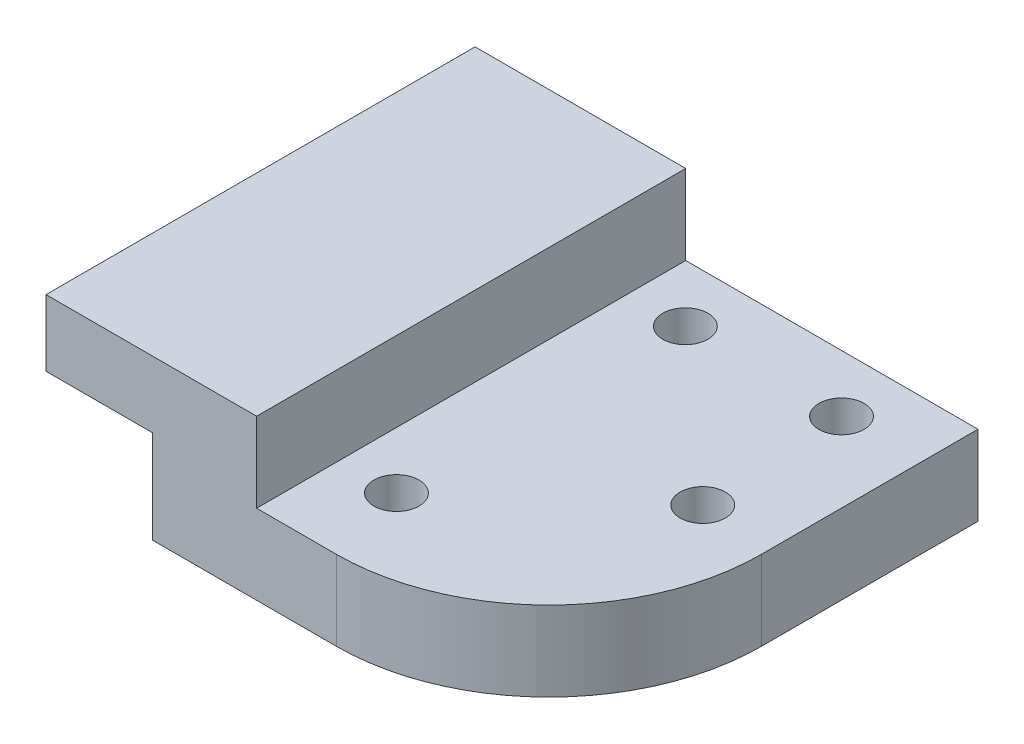
from build123d import *

# Parameters (mm, degrees)
BOSS_EXTRUDE1_DEPTH = 20
SKETCH3_W           = 8
SKETCH3_H           = 8
CUT_EXTRUDE1_DEPTH  = 10
SKETCH4_R           = 1
CUT_EXTRUDE2_DEPTH  = 10
SKETCH5_W           = 4
SKETCH5_H           = 20
CUT_EXTRUDE3_DEPTH  = 0.5
SKETCH6_W           = 8
SKETCH6_H           = 3
BOSS_EXTRUDE2_DEPTH = 8
SKETCH4_2_R         = 1
BOSS_EXTRUDE3_DEPTH = 3
SKETCH7_W           = 20
SKETCH7_H           = 3
BOSS_EXTRUDE4_DEPTH = 3
SKETCH8_W           = 21.136904569
SKETCH8_H           = 7.074304785
CUT_EXTRUDE4_DEPTH  = 3
SKETCH9_R           = 0.85
CUT_EXTRUDE6_DEPTH  = 3
FILLET1_R           = 8
SKETCH9_5_R         = 0.85
CUT_EXTRUDE8_DEPTH  = 3
SKETCH10_W          = 22.706583138
SKETCH10_H          = 8.880510261
CUT_EXTRUDE9_DEPTH  = 0.85
SKETCH4_3_R         = 1
BOSS_EXTRUDE6_DEPTH = 3


with BuildPart() as part:
    # Sketch1 → Boss-Extrude1 (new body)
    with BuildSketch(Plane.XY):
        Polygon((0, 0), (0, 3), (4, 3), (7.927272727, 3), (7.927272727, 0), (15.927272727, 0), (15.927272727, -3), (7.927272727, -3), (4, -3), (4, 0), align=None)
    extrude(amount=BOSS_EXTRUDE1_DEPTH)

    # Sketch3 → Cut-Extrude1 (cut)
    with BuildSketch(Plane(origin=(0, 0, 0), x_dir=(1, 0, 0), z_dir=(0, 1, 0))):
        with Locations((11.927272727, -16)):
            Rectangle(SKETCH3_W, SKETCH3_H)
    extrude(amount=-CUT_EXTRUDE1_DEPTH, mode=Mode.SUBTRACT)

    # Sketch4 → Cut-Extrude2 (cut)
    with BuildSketch(Plane(origin=(0, 0, 0), x_dir=(1, 0, 0), z_dir=(0, 1, 0))):
        with Locations((11.93972935, -3)):
            Circle(SKETCH4_R)
        with Locations((11.93972935, -9)):
            Circle(SKETCH4_R)
    extrude(amount=-CUT_EXTRUDE2_DEPTH, mode=Mode.SUBTRACT)

    # Sketch5 → Cut-Extrude3 (cut)
    with BuildSketch(Plane.XZ):
        with Locations((2, 10)):
            Rectangle(SKETCH5_W, SKETCH5_H)
    extrude(amount=-CUT_EXTRUDE3_DEPTH, mode=Mode.SUBTRACT)

    # Sketch6 → Boss-Extrude2 (add)
    with BuildSketch(Plane.XY.offset(12)):
        with Locations((11.927272727, -1.5)):
            Rectangle(SKETCH6_W, SKETCH6_H)
    extrude(amount=BOSS_EXTRUDE2_DEPTH)

    # Sketch4<2> → Boss-Extrude3 (add)
    with BuildSketch(Plane(origin=(0, 0, 0), x_dir=(1, 0, 0), z_dir=(0, 1, 0))):
        with Locations((11.93972935, -9)):
            Circle(SKETCH4_2_R)
    extrude(amount=-BOSS_EXTRUDE3_DEPTH)

    # Sketch7 → Boss-Extrude4 (add)
    with BuildSketch(Plane(origin=(15.927272727, 0, 0), x_dir=(0, 0, -1), z_dir=(1, 0, 0))):
        with Locations((-10, -1.5)):
            Rectangle(SKETCH7_W, SKETCH7_H)
    extrude(amount=BOSS_EXTRUDE4_DEPTH)

    # Sketch8 → Cut-Extrude4 (cut)
    with BuildSketch(Plane.XY.offset(20)):
        with Locations((9.151850895, 0.075258561)):
            Rectangle(SKETCH8_W, SKETCH8_H)
    extrude(amount=-CUT_EXTRUDE4_DEPTH, mode=Mode.SUBTRACT)

    # Sketch9 → Cut-Extrude6 (cut)
    with BuildSketch(Plane(origin=(0, 0, 0), x_dir=(1, 0, 0), z_dir=(0, 1, 0))):
        with Locations((10.063554841, -13.873545982)):
            Circle(SKETCH9_R)
    extrude(amount=-CUT_EXTRUDE6_DEPTH, mode=Mode.SUBTRACT)

    # Fillet1
    fillet1_edges = [part.edges().sort_by_distance(p)[0] for p in [
        (18.927272727, -1.5, 17),
    ]]
    fillet(fillet1_edges, radius=FILLET1_R)

    # Sketch9<5> → Cut-Extrude8 (cut)
    with BuildSketch(Plane(origin=(0, 0, 0), x_dir=(1, 0, 0), z_dir=(0, 1, 0))):
        with Locations((10.063554841, -13.873545982)):
            Circle(SKETCH9_5_R)
        with Locations((15.93972935, -3)):
            Circle(SKETCH9_5_R)
        with Locations((16.217987441, -8.5)):
            Circle(SKETCH9_5_R)
        with Locations((10.063554841, -3)):
            Circle(SKETCH9_5_R)
    extrude(amount=-CUT_EXTRUDE8_DEPTH, mode=Mode.SUBTRACT)

    # Sketch10 → Cut-Extrude9 (cut)
    with BuildSketch(Plane(origin=(0, 0, 0), x_dir=(-1, 0, 0), z_dir=(0, 0, -1))):
        with Locations((-10.194719533, 0.225775684)):
            Rectangle(SKETCH10_W, SKETCH10_H)
    extrude(amount=-CUT_EXTRUDE9_DEPTH, mode=Mode.SUBTRACT)

    # Sketch4<3> → Boss-Extrude6 (add)
    with BuildSketch(Plane(origin=(0, 0, 0), x_dir=(1, 0, 0), z_dir=(0, 1, 0))):
        with Locations((11.93972935, -3)):
            Circle(SKETCH4_3_R)
    extrude(amount=-BOSS_EXTRUDE6_DEPTH)


solid = part.part
